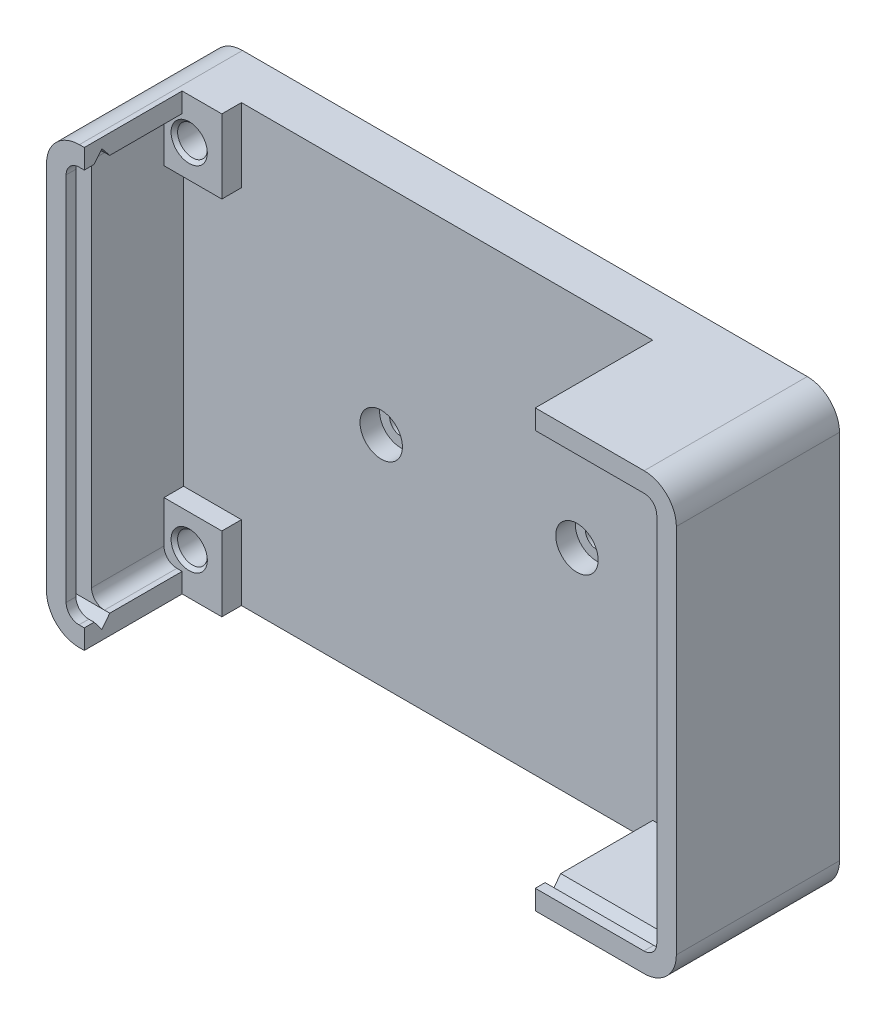
from build123d import *

# Parameters (mm, degrees)
BOSS_EXTRUDE1_DEPTH            = 7
BOSS_EXTRUDE2_DEPTH            = 25
SKETCH2_R                      = 2.275
CUT_EXTRUDE1_DEPTH             = 6
CBORE_FOR_M3_SHCS1_D           = 3.4
CBORE_FOR_M3_SHCS1_DEPTH       = 7
CBORE_FOR_M3_SHCS1_CBORE_D     = 6.5
CBORE_FOR_M3_SHCS1_CBORE_DEPTH = 3
CBORE_FOR_M3_SHCS1_TIP         = 1.021463052
CUT_EXTRUDE2_DEPTH             = 125.119013182
CUT_EXTRUDE2_DEPTH_BACK        = 125.119013182
SKETCH5_W                      = 69.118587288
SKETCH5_H                      = 18
SKETCH6_W                      = 2.4
SKETCH6_H                      = 56.748995089
CUT_EXTRUDE3_DEPTH             = 95.024950421
SKETCH7_R                      = 2.275
BOSS_EXTRUDE3_DEPTH            = 3
CHAMFER1_SIZE                  = 0.5


with BuildPart() as part:
    # Sketch1 → Boss-Extrude1 (new body)
    with BuildSketch(Plane(origin=(0, 0, -11.1516868), x_dir=(-1, 0, 0), z_dir=(0, 0, -1))):
        with BuildLine():
            Line((-25.216678302, 125.2267128), (-25.216678302, 68.477717711))
            ThreePointArc((-25.216678302, 68.477717711), (-25.796051859, 67.07898621), (-27.19478336, 66.499612653))
            Line((-27.19478336, 66.499612653), (-113.777448917, 66.499612653))
            ThreePointArc((-113.777448917, 66.499612653), (-115.166333777, 67.074907598), (-115.741628722, 68.463792459))
            Line((-115.741628722, 68.463792459), (-115.741628722, 125.322842242))
            ThreePointArc((-115.741628722, 125.322842242), (-115.174757862, 126.691389562), (-113.806210541, 127.258260423))
            Line((-113.806210541, 127.258260423), (-27.248225925, 127.258260423))
            ThreePointArc((-27.248225925, 127.258260423), (-25.811704824, 126.6632339), (-25.216678302, 125.2267128))
        make_face()
    extrude(amount=-BOSS_EXTRUDE1_DEPTH)

    # Sketch1<4> → Boss-Extrude2 (add)
    with BuildSketch(Plane(origin=(0, 0, -11.1516868), x_dir=(-1, 0, 0), z_dir=(0, 0, -1))):
        with BuildLine():
            Line((-22.216678302, 125.2267128), (-22.216678302, 68.477717711))
            ThreePointArc((-22.216678302, 68.477717711), (-23.674731516, 64.957665867), (-27.19478336, 63.499612653))
            Line((-27.19478336, 63.499612653), (-113.777448917, 63.499612653))
            ThreePointArc((-113.777448917, 63.499612653), (-117.28765412, 64.953587255), (-118.741628722, 68.463792459))
            Line((-118.741628722, 68.463792459), (-118.741628722, 125.322842242))
            ThreePointArc((-118.741628722, 125.322842242), (-117.296078205, 128.812709906), (-113.806210541, 130.258260423))
            Line((-113.806210541, 130.258260423), (-27.248225925, 130.258260423))
            ThreePointArc((-27.248225925, 130.258260423), (-23.690384481, 128.784554244), (-22.216678302, 125.2267128))
        make_face()
        with BuildLine():
            Line((-25.216678302, 125.2267128), (-25.216678302, 68.477717711))
            ThreePointArc((-25.216678302, 68.477717711), (-25.796051859, 67.07898621), (-27.19478336, 66.499612653))
            Line((-27.19478336, 66.499612653), (-113.777448917, 66.499612653))
            ThreePointArc((-113.777448917, 66.499612653), (-115.166333777, 67.074907598), (-115.741628722, 68.463792459))
            Line((-115.741628722, 68.463792459), (-115.741628722, 125.322842242))
            ThreePointArc((-115.741628722, 125.322842242), (-115.174757862, 126.691389562), (-113.806210541, 127.258260423))
            Line((-113.806210541, 127.258260423), (-27.248225925, 127.258260423))
            ThreePointArc((-27.248225925, 127.258260423), (-25.811704824, 126.6632339), (-25.216678302, 125.2267128))
        make_face(mode=Mode.SUBTRACT)
    extrude(amount=-BOSS_EXTRUDE2_DEPTH)

    # Sketch2 → Cut-Extrude1 (cut)
    with BuildSketch(Plane.XY.offset(-4.1516868)):
        with Locations((111.633, 123.952)):
            Circle(SKETCH2_R)
        with Locations((111.633, 69.901)):
            Circle(SKETCH2_R)
        with Locations((29.083, 69.901)):
            Circle(SKETCH2_R)
        with Locations((29.083, 123.952)):
            Circle(SKETCH2_R)
    extrude(amount=-CUT_EXTRUDE1_DEPTH, mode=Mode.SUBTRACT)

    # CBORE for M3 SHCS1
    with Locations(Plane.XY.offset(-4.1516868)):
        with Locations((55.506677482, 96.899230975), (85.506670618, 96.878936538)):
            CounterBoreHole(CBORE_FOR_M3_SHCS1_D / 2, CBORE_FOR_M3_SHCS1_CBORE_D / 2, CBORE_FOR_M3_SHCS1_CBORE_DEPTH, depth=CBORE_FOR_M3_SHCS1_DEPTH)
            with Locations((0, 0, -(CBORE_FOR_M3_SHCS1_DEPTH + CBORE_FOR_M3_SHCS1_TIP / 2))):  # 118° drill point
                Cone(0, CBORE_FOR_M3_SHCS1_D / 2, CBORE_FOR_M3_SHCS1_TIP, mode=Mode.SUBTRACT)

    # Sketch5 → Cut-Extrude2 (cut, two sides: drawn at the far end of the back side and taken through both)
    with BuildSketch(Plane(origin=(0, 96.878936538, 0), x_dir=(-1, 0, 0), z_dir=(0, -1, 0)).offset(-CUT_EXTRUDE2_DEPTH_BACK)):
        with Locations((-62.563646937, -4.8483132)):
            Rectangle(SKETCH5_W, SKETCH5_H)
    extrude(amount=CUT_EXTRUDE2_DEPTH + CUT_EXTRUDE2_DEPTH_BACK, mode=Mode.SUBTRACT)

    # Sketch6 → Cut-Extrude3 (cut)
    with BuildSketch(Plane(origin=(22.216678302, -0.007433612, 0), x_dir=(0, 0, 1), z_dir=(-1, 0, 0))):
        with Locations((11.1483132, 96.859648867)):
            Rectangle(SKETCH6_W, SKETCH6_H)
        Polygon((12.3483132, 127.265694035), (11.1483132, 128.765694035), (9.9483132, 127.265694035), (9.9483132, 125.234146412), (12.3483132, 125.234146412), align=None)
        Polygon((12.3483132, 68.485151323), (9.9483132, 68.485151323), (9.9483132, 66.507046265), (11.1483132, 64.953603699), (12.3483132, 66.507046265), align=None)
    extrude(amount=-CUT_EXTRUDE3_DEPTH, mode=Mode.SUBTRACT)

    # Sketch7 → Boss-Extrude3 (add)
    # profile 1 of 4: a face of its own
    with BuildSketch(Plane.XY.offset(-4.1516868)):
        with BuildLine():
            Line((25.216678302, 125.2267128), (25.216678302, 118.952))
            Line((25.216678302, 118.952), (34.083, 118.952))
            Line((34.083, 118.952), (34.083, 130.258260423))
            Line((34.083, 130.258260423), (28.004353293, 130.258260423))
            Line((28.004353293, 130.258260423), (28.004353293, 127.258260423))
            Line((28.004353293, 127.258260423), (27.248225925, 127.258260423))
            ThreePointArc((27.248225925, 127.258260423), (25.811704824, 126.6632339), (25.216678302, 125.2267128))
        make_face()
        with Locations((29.083, 123.952)):
            Circle(SKETCH7_R, mode=Mode.SUBTRACT)
    # profile 2 of 4: a face of its own
    with BuildSketch(Plane.XY.offset(-4.1516868)):
        with BuildLine():
            Line((34.083, 74.901), (25.216678302, 74.901))
            Line((25.216678302, 74.901), (25.216678302, 68.477717711))
            ThreePointArc((25.216678302, 68.477717711), (25.796051859, 67.07898621), (27.19478336, 66.499612653))
            Line((27.19478336, 66.499612653), (28.004353293, 66.499612653))
            Line((28.004353293, 66.499612653), (28.004353293, 63.499612653))
            Line((28.004353293, 63.499612653), (34.083, 63.499612653))
            Line((34.083, 63.499612653), (34.083, 74.901))
        make_face()
        with Locations((29.083, 69.901)):
            Circle(SKETCH7_R, mode=Mode.SUBTRACT)
    # profile 3 of 4: a face of its own
    with BuildSketch(Plane.XY.offset(-4.1516868)):
        with BuildLine():
            Line((106.633, 118.952), (115.741628722, 118.952))
            Line((115.741628722, 118.952), (115.741628722, 125.322842242))
            ThreePointArc((115.741628722, 125.322842242), (115.174757862, 126.691389562), (113.806210541, 127.258260423))
            Line((113.806210541, 127.258260423), (106.633, 127.258260423))
            Line((106.633, 127.258260423), (106.633, 118.952))
        make_face()
        with Locations((111.633, 123.952)):
            Circle(SKETCH7_R, mode=Mode.SUBTRACT)
    # profile 4 of 4: a face of its own
    with BuildSketch(Plane.XY.offset(-4.1516868)):
        with BuildLine():
            Line((115.741628722, 68.463792459), (115.741628722, 74.901))
            Line((115.741628722, 74.901), (106.633, 74.901))
            Line((106.633, 74.901), (106.633, 66.499612653))
            Line((106.633, 66.499612653), (113.777448917, 66.499612653))
            ThreePointArc((113.777448917, 66.499612653), (115.166333777, 67.074907598), (115.741628722, 68.463792459))
        make_face()
        with Locations((111.633, 69.901)):
            Circle(SKETCH7_R, mode=Mode.SUBTRACT)
    extrude(amount=BOSS_EXTRUDE3_DEPTH)

    # Chamfer1
    chamfer1_edges = [part.edges().sort_by_distance(p)[0] for p in [
        (26.808, 69.901, -1.1516868),
        (109.358, 123.952, -1.1516868),
        (109.358, 69.901, -1.1516868),
        (26.808, 123.952, -1.1516868),
    ]]
    chamfer(chamfer1_edges, length=CHAMFER1_SIZE)


solid = part.part
